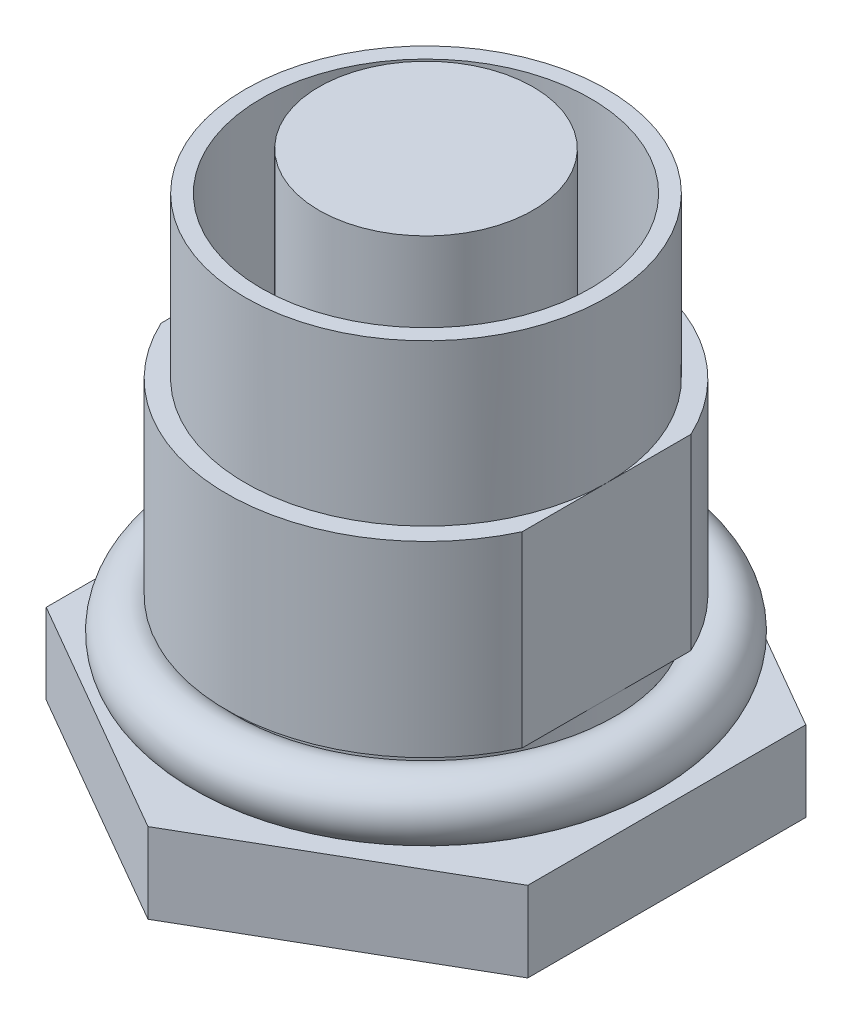
from build123d import *

# Parameters (mm, degrees)
SKETCH1_R           = 6.75
BOSS_EXTRUDE1_DEPTH = 18.3
BOSS_EXTRUDE2_DEPTH = 3
SKETCH3_R           = 6.15
CUT_EXTRUDE1_DEPTH  = 15.3
SKETCH4_R           = 4
BOSS_EXTRUDE3_DEPTH = 16.75
SKETCH5_R           = 1.125
BOSS_EXTRUDE4_START = -7
BOSS_EXTRUDE4_DEPTH = 7


with BuildPart() as part:
    # Sketch1 → Boss-Extrude1 (new body)
    with BuildSketch(Plane(origin=(0, 0, 0), x_dir=(1, 0, 0), z_dir=(0, 1, 0))):
        with Locations(Location((0, 0, 0), (0, 0, 270))):
            Circle(SKETCH1_R)
    extrude(amount=BOSS_EXTRUDE1_DEPTH)

    # Sketch2 → Boss-Extrude2 (add)
    with BuildSketch(Plane.XZ):
        Polygon((0, 10.392304845), (-9, 5.196152423), (-9, -5.196152423), (0, -10.392304845), (9, -5.196152423), (9, 5.196152423), align=None)
    extrude(amount=-BOSS_EXTRUDE2_DEPTH)

    # Sketch3 → Cut-Extrude1 (cut)
    with BuildSketch(Plane(origin=(0, 18.3, 0), x_dir=(1, 0, 0), z_dir=(0, 1, 0))):
        with Locations(Location((0, 0, 0), (0, 0, 270))):
            Circle(SKETCH3_R)
    extrude(amount=-CUT_EXTRUDE1_DEPTH, mode=Mode.SUBTRACT)

    # Sketch4 → Boss-Extrude3 (add)
    with BuildSketch(Plane(origin=(0, 3, 0), x_dir=(1, 0, 0), z_dir=(0, 1, 0))):
        with Locations(Location((0, 0, 0), (0, 0, 90))):
            Circle(SKETCH4_R)
    extrude(amount=BOSS_EXTRUDE3_DEPTH)

    # Sketch6 → Boss-Extrude4 (add)
    with BuildSketch(Plane(origin=(0, 12.3, 0), x_dir=(1, 0, 0), z_dir=(0, 1, 0)).offset(BOSS_EXTRUDE4_START)):
        with BuildLine():
            Line((-6.75, 3.152776554), (-6.75, 0))
            ThreePointArc((-6.75, 0), (0, 6.75), (6.75, 0))
            Line((6.75, 0), (6.75, 3.152776554))
            ThreePointArc((6.75, 3.152776554), (0, 7.45), (-6.75, 3.152776554))
        make_face()
        with BuildLine():
            ThreePointArc((6.75, 0), (0, -6.75), (-6.75, 0))
            Line((-6.75, 0), (-6.75, -3.152776554))
            ThreePointArc((-6.75, -3.152776554), (0, -7.45), (6.75, -3.152776554))
            Line((6.75, -3.152776554), (6.75, 0))
        make_face()
    extrude(amount=BOSS_EXTRUDE4_DEPTH)


with BuildPart() as body_2:
    # Sketch5 → Revolve1 (revolve)
    with BuildSketch(Plane.XY, mode=Mode.PRIVATE) as revolve1_sk:
        with Locations((-7.875, 4.125)):
            Circle(SKETCH5_R)
    revolve(revolve1_sk.sketch.rotate(Axis((0, -2.633476414, 0), (0, 1, 0)), 270), axis=Axis((0, -2.633476414, 0), (0, 1, 0)))


solid = Compound([part.part, body_2.part])
